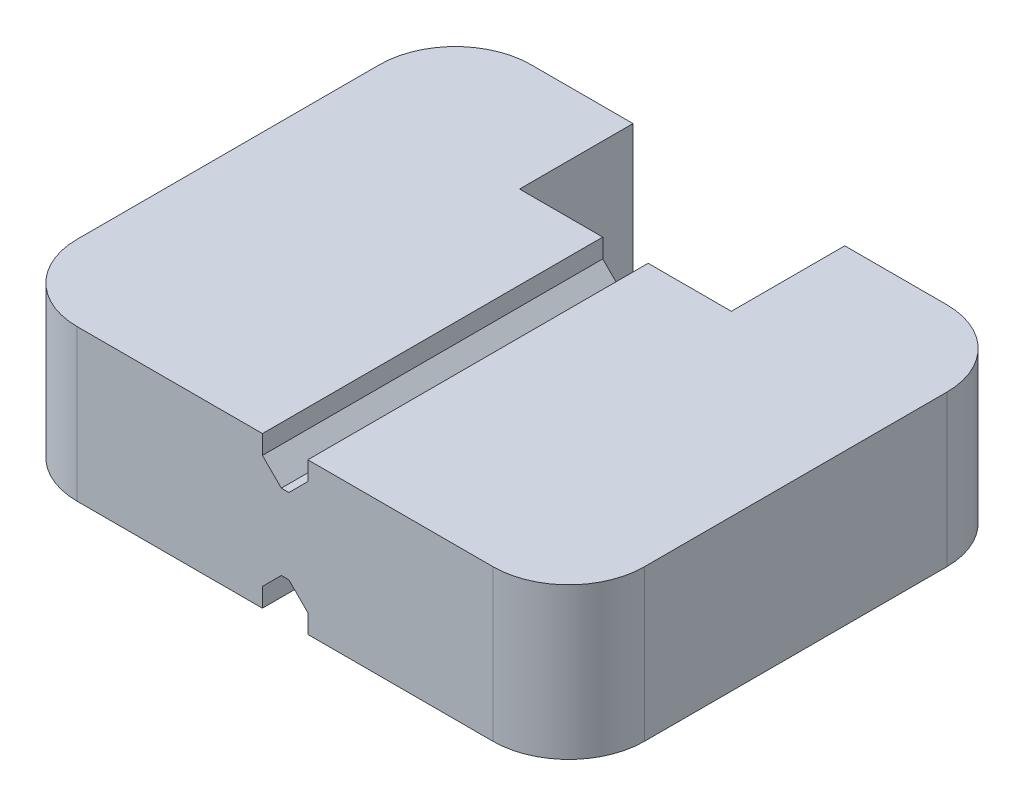
from build123d import *

# Parameters (mm, degrees)
ESBO_O1_W                = 15
ESBO_O1_H                = 12
RESSALTO_EXTRUS_O1_DEPTH = 4
ESBO_O2_W                = 5.6
ESBO_O2_H                = 6
CORTE_EXTRUS_O1_DEPTH    = 11.404326023
ESBO_O3_W                = 1.2
ESBO_O3_H                = 10
CORTE_EXTRUS_O2_DEPTH    = 1
CHANFRO1_SIZE            = 0.5
FILETE1_R                = 2
FILETE2_R                = 2
FILETE3_R                = 2
FILETE4_R                = 2
ESBO_O4_W                = 1.2
ESBO_O4_H                = 10
CORTE_EXTRUS_O3_DEPTH    = 1
CHANFRO2_SIZE            = 0.5


with BuildPart() as part:
    # Esboço1 → Ressalto-extrusão1 (new body)
    with BuildSketch(Plane(origin=(0, 0, 0), x_dir=(1, 0, 0), z_dir=(0, 1, 0))):
        Rectangle(ESBO_O1_W, ESBO_O1_H)
    extrude(amount=RESSALTO_EXTRUS_O1_DEPTH)

    # Esboço2 → Corte-extrusão1 (cut, through all)
    with BuildSketch(Plane(origin=(0, 4, 0), x_dir=(1, 0, 0), z_dir=(0, 1, 0))):
        with Locations((0, 6)):
            Rectangle(ESBO_O2_W, ESBO_O2_H)
    extrude(amount=-CORTE_EXTRUS_O1_DEPTH, mode=Mode.SUBTRACT)

    # Esboço3 → Corte-extrusão2 (cut)
    with BuildSketch(Plane(origin=(0, 4, 0), x_dir=(1, 0, 0), z_dir=(0, 1, 0))):
        with Locations((0, -2)):
            Rectangle(ESBO_O3_W, ESBO_O3_H)
    extrude(amount=-CORTE_EXTRUS_O2_DEPTH, mode=Mode.SUBTRACT)

    # Chanfro1
    chanfro1_edges = [part.edges().sort_by_distance(p)[0] for p in [
        (0.6, 3, 1.5),
        (-0.6, 3, 1.5),
    ]]
    chamfer(chanfro1_edges, length=CHANFRO1_SIZE)

    # Filete1
    filete1_edges = [part.edges().sort_by_distance(p)[0] for p in [
        (7.5, 2, 6),
    ]]
    fillet(filete1_edges, radius=FILETE1_R)

    # Filete2
    filete2_edges = [part.edges().sort_by_distance(p)[0] for p in [
        (7.5, 2, -6),
    ]]
    fillet(filete2_edges, radius=FILETE2_R)

    # Filete3
    filete3_edges = [part.edges().sort_by_distance(p)[0] for p in [
        (-7.5, 2, 6),
    ]]
    fillet(filete3_edges, radius=FILETE3_R)

    # Filete4
    filete4_edges = [part.edges().sort_by_distance(p)[0] for p in [
        (-7.5, 2, -6),
    ]]
    fillet(filete4_edges, radius=FILETE4_R)

    # Esboço4 → Corte-extrusão3 (cut)
    with BuildSketch(Plane.XZ):
        with Locations((0, 2)):
            Rectangle(ESBO_O4_W, ESBO_O4_H)
    extrude(amount=-CORTE_EXTRUS_O3_DEPTH, mode=Mode.SUBTRACT)

    # Chanfro2
    chanfro2_edges = [part.edges().sort_by_distance(p)[0] for p in [
        (0.6, 1, 1.5),
        (-0.6, 1, 1.5),
    ]]
    chamfer(chanfro2_edges, length=CHANFRO2_SIZE)


solid = part.part
